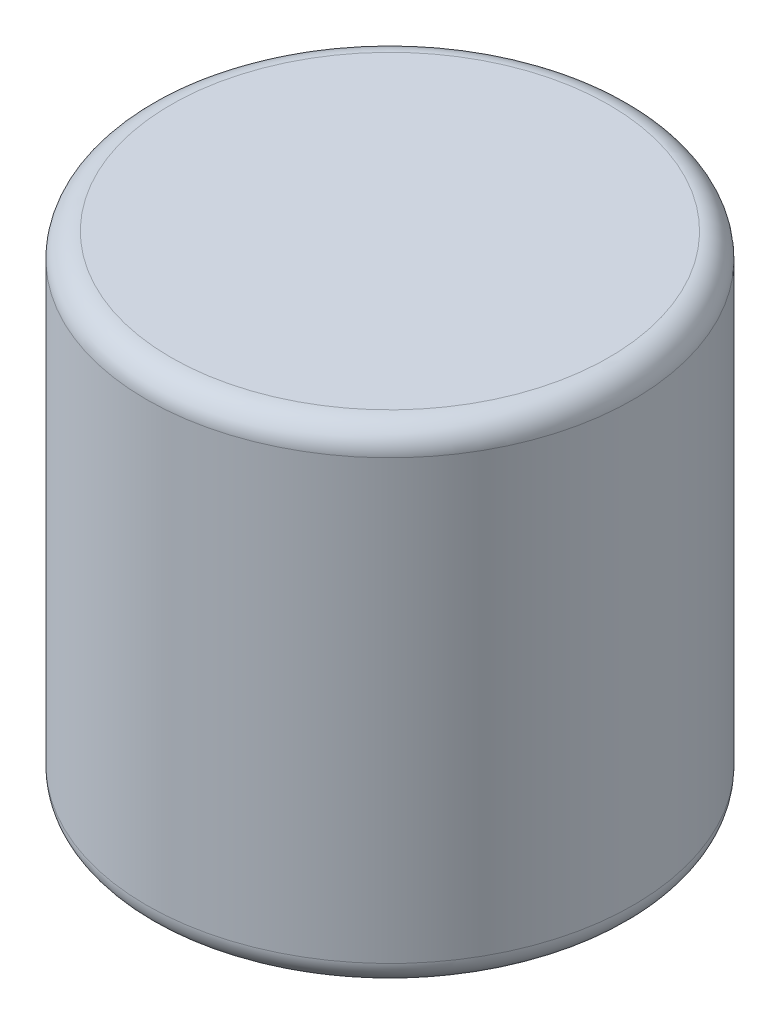
from build123d import *

# Parameters (mm, degrees)
SKETCH1_R           = 5
BOSS_EXTRUDE1_DEPTH = 10
FILLET1_R           = 0.5


with BuildPart() as part:
    # Sketch1 → Boss-Extrude1 (new body)
    with BuildSketch(Plane(origin=(0, 0, 0), x_dir=(1, 0, 0), z_dir=(0, 1, 0))):
        with Locations(Location((0, 0, 0), (0, 0, 270))):
            Circle(SKETCH1_R)
    extrude(amount=BOSS_EXTRUDE1_DEPTH)

    # Fillet1
    fillet1_edges = [part.edges().sort_by_distance(p)[0] for p in [
        (0, 0, -5),
        (0, 10, -5),
    ]]
    fillet(fillet1_edges, radius=FILLET1_R)


solid = part.part
